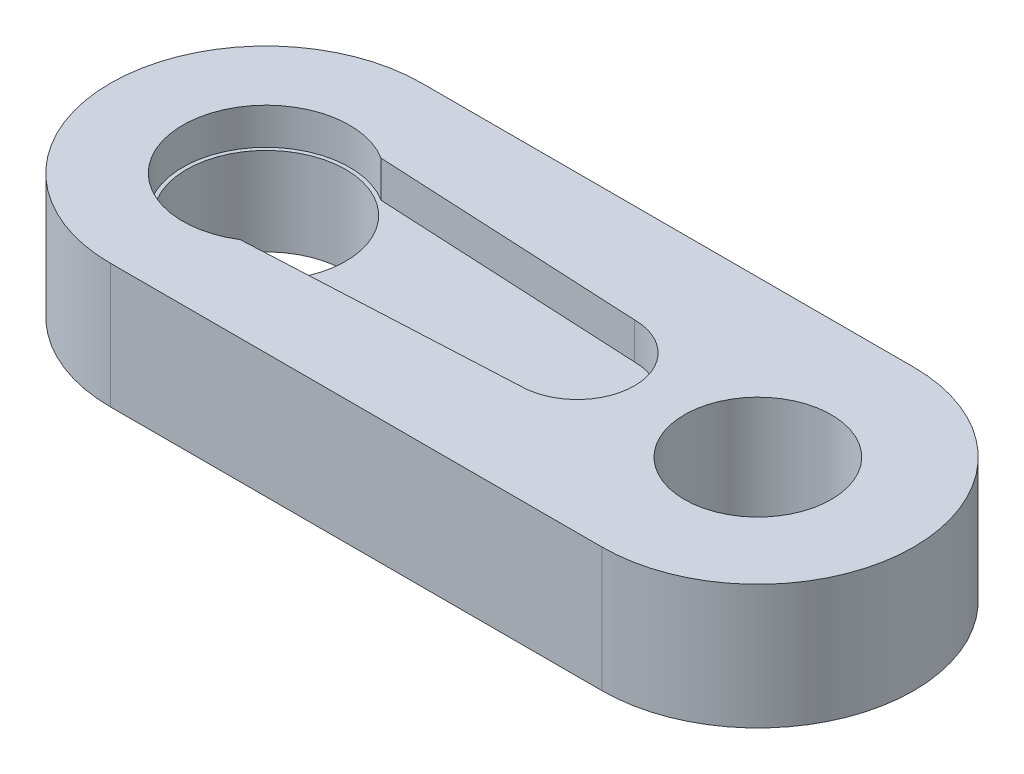
from build123d import *

# Parameters (mm, degrees)
BOSS_EXTRUDE1_DEPTH = 3.95
SKETCH2_R           = 3.575
CUT_EXTRUDE1_DEPTH  = 3.95
BOSS_EXTRUDE2_DEPTH = 1.64
SKETCH4_R           = 3.3
CUT_EXTRUDE2_DEPTH  = 31.43771091


with BuildPart() as part:
    # Sketch1 → Boss-Extrude1 (new body)
    with BuildSketch(Plane(origin=(0, 0, 0), x_dir=(1, 0, 0), z_dir=(0, 1, 0))):
        with BuildLine():
            Line((0, 7), (22.089622642, 7))
            ThreePointArc((22.089622642, 7), (29.089622642, 0), (22.089622642, -7))
            Line((22.089622642, -7), (0, -7))
            ThreePointArc((0, -7), (-7, 0), (0, 7))
        make_face()
    extrude(amount=BOSS_EXTRUDE1_DEPTH)

    # Sketch2 → Cut-Extrude1 (cut)
    with BuildSketch(Plane.XZ):
        with Locations(Location((0, 0, 0), (0, 0, 270))):
            Circle(SKETCH2_R)
    extrude(amount=-CUT_EXTRUDE1_DEPTH, mode=Mode.SUBTRACT)

    # Sketch3 → Boss-Extrude2 (add)
    with BuildSketch(Plane(origin=(0, 3.95, 0), x_dir=(1, 0, 0), z_dir=(0, 1, 0))):
        with BuildLine():
            Line((0, -7), (22.089622642, -7))
            ThreePointArc((22.089622642, -7), (29.089622642, 0), (22.089622642, 7))
            Line((22.089622642, 7), (0, 7))
            ThreePointArc((0, 7), (-7, 0), (0, -7))
        make_face()
        with BuildLine():
            Line((13.979308982, 2.569996388), (1.997926282, 3.167540934))
            ThreePointArc((1.997926282, 3.167540934), (-3.745, 0), (1.997926282, -3.167540934))
            Line((1.997926282, -3.167540934), (13.979308982, -2.569996388))
            ThreePointArc((13.979308982, -2.569996388), (16.545, 0), (13.979308982, 2.569996388))
        make_face(mode=Mode.SUBTRACT)
    extrude(amount=BOSS_EXTRUDE2_DEPTH)

    # Sketch4 → Cut-Extrude2 (cut, through all)
    with BuildSketch(Plane(origin=(0, 5.59, 0), x_dir=(1, 0, 0), z_dir=(0, 1, 0))):
        with Locations(Location((22.089622642, 0, 0), (0, 0, 270))):
            Circle(SKETCH4_R)
    extrude(amount=-CUT_EXTRUDE2_DEPTH, mode=Mode.SUBTRACT)


solid = part.part
